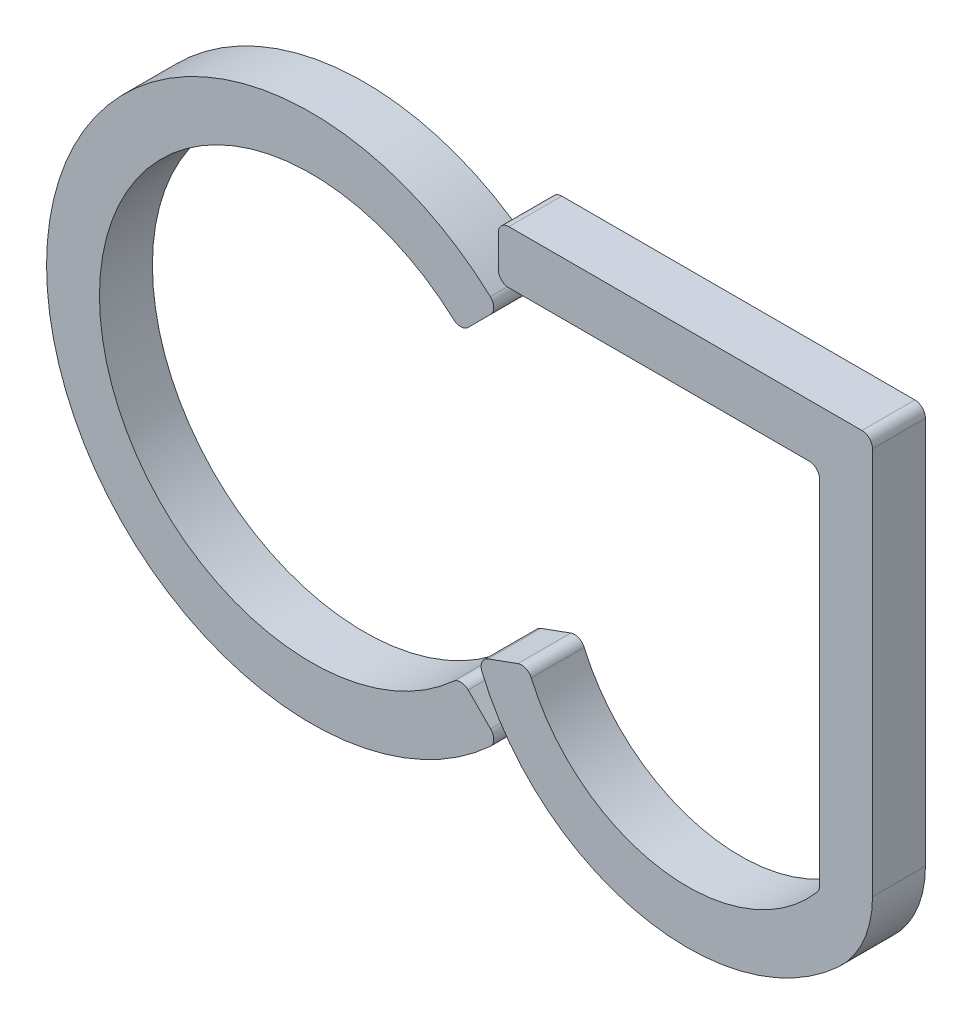
from build123d import *

# Parameters (mm, degrees)
SALIENTE_EXTRUIR1_DEPTH   = 10
SALIENTE_EXTRUIR1_2_DEPTH = 10
REDONDEO1_R               = 20
REDONDEO4_R               = 2
REDONDEO5_R               = 2
REDONDEO6_R               = 2


with BuildPart() as part:
    # Croquis1 → Saliente-Extruir1 (new body)
    with BuildSketch(Plane.XY):
        with BuildLine():
            Line((35.355339059, -35.355339059), (28.284271247, -28.284271247))
            ThreePointArc((28.284271247, -28.284271247), (-40, 0), (28.284271247, 28.284271247))
            Line((28.284271247, 28.284271247), (35.355339059, 35.355339059))
            ThreePointArc((35.355339059, 35.355339059), (-50, 0), (35.355339059, -35.355339059))
        make_face()
    extrude(amount=SALIENTE_EXTRUIR1_DEPTH)

    # Redondeo6
    redondeo6_edges = [part.edges().sort_by_distance(p)[0] for p in [
        (28.284271247, -28.284271247, 5),
        (35.355339059, -35.355339059, 5),
        (35.355339059, 35.355339059, 5),
        (28.284271247, 28.284271247, 5),
    ]]
    fillet(redondeo6_edges, radius=REDONDEO6_R)


with BuildPart() as body_2:
    # Croquis1 → Saliente-Extruir1 2 (new body)
    with BuildSketch(Plane.XY):
        with BuildLine():
            Line((35.355339059, 50), (106.070861158, 50))
            Line((106.070861158, 50), (106.070861158, -32.495099916))
            ThreePointArc((106.070861158, -32.495099916), (65.995018822, -50.82037074), (31.496290842, -23.402740327))
            Line((31.496290842, -23.402740327), (40.89321705, -19.982538894))
            ThreePointArc((40.89321705, -19.982538894), (65.788989313, -40.6891053), (96.070861158, -29.218725775))
            Line((96.070861158, -29.218725775), (96.070861158, 40))
            Line((96.070861158, 40), (35.355339059, 40))
            Line((35.355339059, 40), (35.355339059, 50))
        make_face()
    extrude(amount=SALIENTE_EXTRUIR1_2_DEPTH)

    # Redondeo1
    redondeo1_edges = [body_2.edges().sort_by_distance(p)[0] for p in [
        (106.070861158, -32.495099916, 5),
    ]]
    fillet(redondeo1_edges, radius=REDONDEO1_R)

    # Redondeo4
    redondeo4_edges = [body_2.edges().sort_by_distance(p)[0] for p in [
        (106.070861158, 50, 5),
    ]]
    fillet(redondeo4_edges, radius=REDONDEO4_R)

    # Redondeo5
    redondeo5_edges = [body_2.edges().sort_by_distance(p)[0] for p in [
        (31.496290842, -23.402740327, 5),
        (40.89321705, -19.982538894, 5),
        (96.070861158, -29.218725775, 5),
        (96.070861158, 40, 5),
        (35.355339059, 40, 5),
        (35.355339059, 50, 5),
    ]]
    fillet(redondeo5_edges, radius=REDONDEO5_R)


solid = Compound([part.part, body_2.part])
